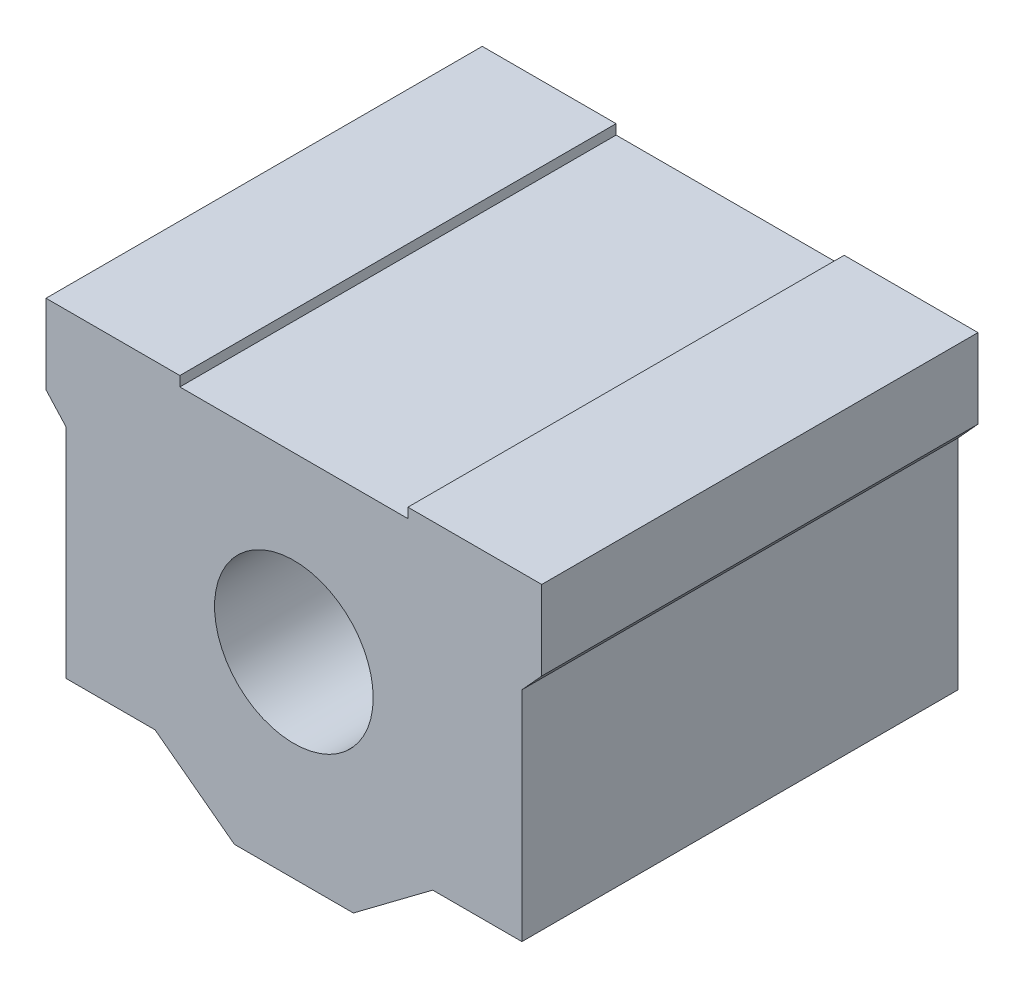
from build123d import *

# Parameters (mm, degrees)
SKETCH_1_R      = 8
EXTRUDE_1_DEPTH = 44


with BuildPart() as part:
    # 草图1 → 凸台-拉伸1 (new body)
    with BuildSketch(Plane.XY):
        Polygon((6, 0), (-6, 0), (-14, 6), (-23, 6), (-23, 28), (-25, 30.2), (-25, 38.2), (-11.5, 38.2), (-11.5, 37.2), (11.5, 37.2), (11.5, 38.2), (25, 38.2), (25, 30.2), (23, 28), (23, 6), (14, 6), align=None)
        with Locations((0, 19.8)):
            Circle(SKETCH_1_R, mode=Mode.SUBTRACT)
    extrude(amount=EXTRUDE_1_DEPTH)


solid = part.part
